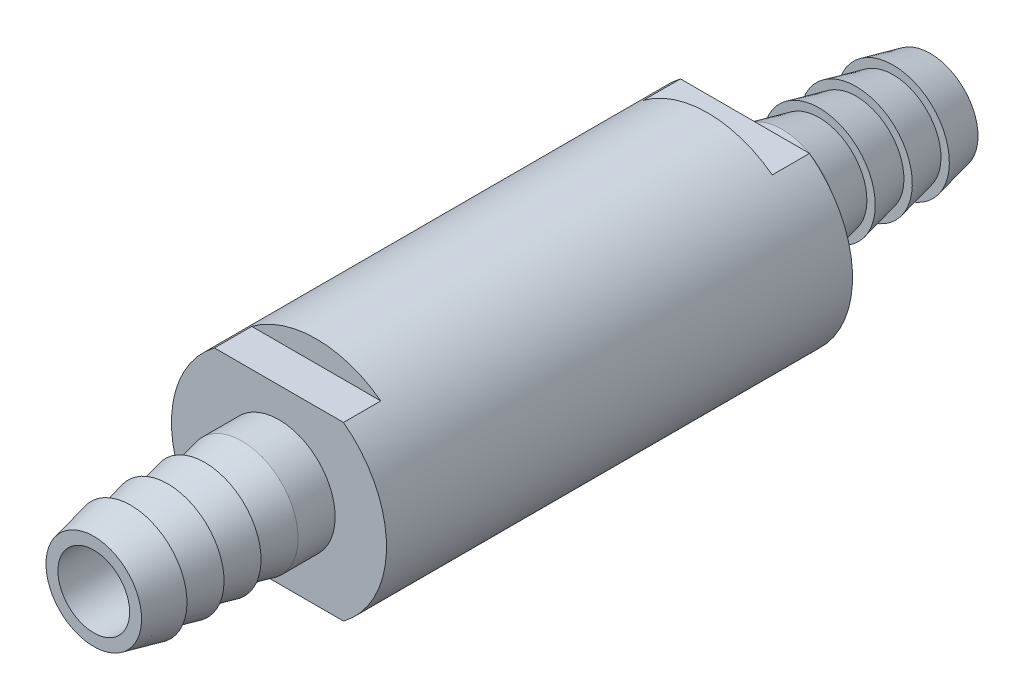
from build123d import *

# Parameters (mm, degrees)
CUT_EXTRUDE1_DEPTH   = 4.953
MIRROR2_COPY_1_DEPTH = 4.953
LPATTERN1_COUNT      = 4
LPATTERN1_PITCH      = 4.92125
SKETCH5_R            = 4.7625
CUT_EXTRUDE2_DEPTH   = 24.60625


with BuildPart() as part:
    # Sketch2 → Revolve1 (revolve)
    with BuildSketch(Plane(origin=(0, 0, 0), x_dir=(0, 0, -1), z_dir=(1, 0, 0))):
        Polygon((-55.5625, 0), (-55.5625, 7.46125), (-30.95625, 7.46125), (-30.95625, 14.2875), (30.95625, 14.2875), (30.95625, 7.46125), (55.5625, 7.46125), (55.5625, 0), align=None)
    revolve(axis=Axis((0, 0, -30.95625), (0, 0, 1)))

    # Sketch3 → Cut-Extrude1 (cut)
    with BuildSketch(Plane(origin=(0, 0, -30.95625), x_dir=(-1, 0, 0), z_dir=(0, 0, -1))):
        with BuildLine():
            Line((-8.5725, 11.43), (8.5725, 11.43))
            ThreePointArc((8.5725, 11.43), (0, 14.2875), (-8.5725, 11.43))
        make_face()
    cut_extrude1 = extrude(amount=-CUT_EXTRUDE1_DEPTH, mode=Mode.SUBTRACT)

    # Mirror1: Cut-Extrude1 across plane
    add(cut_extrude1.mirror(Plane.ZX), mode=Mode.SUBTRACT)

    # Mirror2: Cut-Extrude1 across plane
    add(cut_extrude1.mirror(Plane.XY), mode=Mode.SUBTRACT)

    # Mirror2 copy 1 sketch → Mirror2 copy 1 (cut)
    with BuildSketch(Plane(origin=(0, 0, 30.95625), x_dir=(-1, 0, 0), z_dir=(0, 0, 1))):
        with BuildLine():
            Line((-8.5725, 11.43), (8.5725, 11.43))
            ThreePointArc((8.5725, 11.43), (0, 14.2875), (-8.5725, 11.43))
        make_face()
    extrude(amount=-MIRROR2_COPY_1_DEPTH, mode=Mode.SUBTRACT)

    # Sketch4 → Cut-Revolve1 (revolve, cut)
    with BuildSketch(Plane(origin=(0, 0, 0), x_dir=(0, 0, -1), z_dir=(1, 0, 0))):
        Polygon((-55.5625, 7.46125), (-55.5625, 6.35), (-50.64125, 7.46125), align=None)
    cut_revolve1 = revolve(axis=Axis((0, 0, -55.5625), (0, 0, 1)), mode=Mode.SUBTRACT)

    # LPattern1: Cut-Revolve1 ×4
    with Locations(*[(0, 0, -i * LPATTERN1_PITCH) for i in range(1, LPATTERN1_COUNT)]):
        add(cut_revolve1, mode=Mode.SUBTRACT)

    # Mirror3: Cut-Revolve1 across plane
    add(cut_revolve1.mirror(Plane.XY), mode=Mode.SUBTRACT)

    # Mirror3 copy 1 sketch → Mirror3 copy 1 (revolve, cut)
    with BuildSketch(Plane(origin=(0, 0, 4.92125), x_dir=(0, 0, 1), z_dir=(1, 0, 0))):
        Polygon((-55.5625, -7.46125), (-55.5625, -6.35), (-50.64125, -7.46125), align=None)
    revolve(axis=Axis((0, 0, 60.48375), (0, 0, 1)), mode=Mode.SUBTRACT)

    # Mirror3 copy 2 sketch → Mirror3 copy 2 (revolve, cut)
    with BuildSketch(Plane(origin=(0, 0, 9.8425), x_dir=(0, 0, 1), z_dir=(1, 0, 0))):
        Polygon((-55.5625, -7.46125), (-55.5625, -6.35), (-50.64125, -7.46125), align=None)
    revolve(axis=Axis((0, 0, 65.405), (0, 0, 1)), mode=Mode.SUBTRACT)

    # Mirror3 copy 3 sketch → Mirror3 copy 3 (revolve, cut)
    with BuildSketch(Plane(origin=(0, 0, 14.76375), x_dir=(0, 0, 1), z_dir=(1, 0, 0))):
        Polygon((-55.5625, -7.46125), (-55.5625, -6.35), (-50.64125, -7.46125), align=None)
    revolve(axis=Axis((0, 0, 70.32625), (0, 0, 1)), mode=Mode.SUBTRACT)

    # Sketch5 → Cut-Extrude2 (cut)
    with BuildSketch(Plane.XY.offset(55.5625)):
        Circle(SKETCH5_R)
    cut_extrude2 = extrude(amount=-CUT_EXTRUDE2_DEPTH, mode=Mode.SUBTRACT)

    # Mirror4: Cut-Extrude2 across plane
    add(cut_extrude2.mirror(Plane.XY), mode=Mode.SUBTRACT)


solid = part.part
